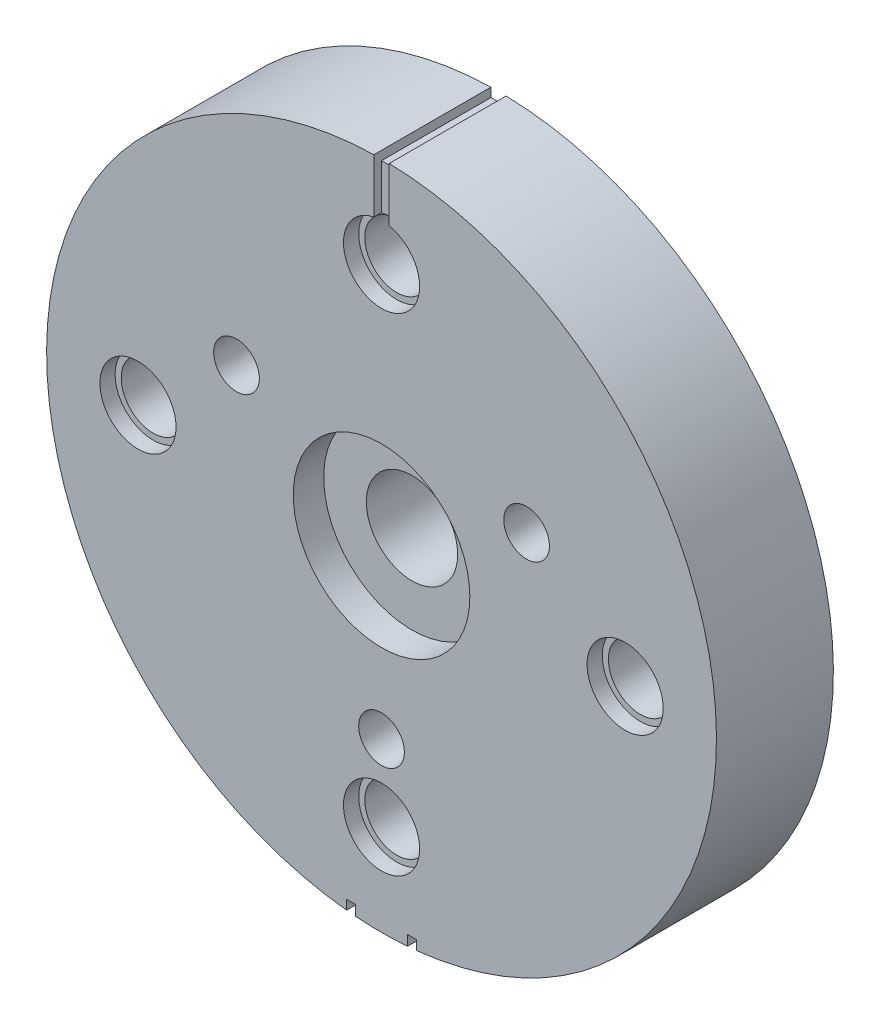
from build123d import *

# Parameters (mm, degrees)
SKETCH5_R           = 11
BOSS_EXTRUDE3_DEPTH = 3.84
SKETCH6_R           = 1.5
CUT_EXTRUDE16_DEPTH = 3.84
SKETCH6_8_R         = 2.9
SKETCH6_8_R_2       = 1.5
CUT_EXTRUDE17_DEPTH = 1
SKETCH7_R           = 0.75
CUT_EXTRUDE18_DEPTH = 2
SKETCH8_R           = 1.05
CUT_EXTRUDE20_DEPTH = 3
SKETCH8_4_R         = 1.25
SKETCH8_4_R_2       = 1.05
CUT_EXTRUDE21_DEPTH = 0.5
SKETCH15_W          = 0.299586516
SKETCH15_H          = 0.370347028
SKETCH15_W_2        = 0.300671414
CUT_EXTRUDE22_DEPTH = 3.84
SKETCH16_W          = 0.5
SKETCH16_H          = 0.298358963
CUT_EXTRUDE23_DEPTH = 3.84
SKETCH17_W          = 0.5
SKETCH17_H          = 1.60013733
CUT_EXTRUDE24_DEPTH = 0.25


with BuildPart() as part:
    # Sketch5 → Boss-Extrude3 (new body)
    with BuildSketch(Plane.XY):
        Circle(SKETCH5_R)
    extrude(amount=-BOSS_EXTRUDE3_DEPTH)

    # Sketch6 → Cut-Extrude16 (cut)
    with BuildSketch(Plane.XY):
        Circle(SKETCH6_R)
    extrude(amount=-CUT_EXTRUDE16_DEPTH, mode=Mode.SUBTRACT)

    # Sketch6<8> → Cut-Extrude17 (cut)
    with BuildSketch(Plane.XY):
        Circle(SKETCH6_8_R)
        Circle(SKETCH6_8_R_2, mode=Mode.SUBTRACT)
    extrude(amount=-CUT_EXTRUDE17_DEPTH, mode=Mode.SUBTRACT)

    # Sketch7 → Cut-Extrude18 (cut)
    with BuildSketch(Plane.XY):
        with Locations((-4.763139721, 2.75)):
            Circle(SKETCH7_R)
        with Locations((4.763139721, 2.75)):
            Circle(SKETCH7_R)
        with Locations((0, -5.5)):
            Circle(SKETCH7_R)
    extrude(amount=-CUT_EXTRUDE18_DEPTH, mode=Mode.SUBTRACT)

    # Sketch8 → Cut-Extrude20 (cut)
    with BuildSketch(Plane.XY):
        with Locations((-8, 0)):
            Circle(SKETCH8_R)
        with Locations((0, -8)):
            Circle(SKETCH8_R)
        with Locations((8, 0)):
            Circle(SKETCH8_R)
        with Locations((0, 8)):
            Circle(SKETCH8_R)
    extrude(amount=-CUT_EXTRUDE20_DEPTH, mode=Mode.SUBTRACT)

    # Sketch8<4> → Cut-Extrude21 (cut)
    # profile 1 of 4: a face of its own
    with BuildSketch(Plane.XY):
        with Locations((-8, 0)):
            Circle(SKETCH8_4_R)
        with Locations((-8, 0)):
            Circle(SKETCH8_4_R_2, mode=Mode.SUBTRACT)
    # profile 2 of 4: a face of its own
    with BuildSketch(Plane.XY):
        with Locations((0, -8)):
            Circle(SKETCH8_4_R)
        with Locations((0, -8)):
            Circle(SKETCH8_4_R_2, mode=Mode.SUBTRACT)
    # profile 3 of 4: a face of its own
    with BuildSketch(Plane.XY):
        with Locations((8, 0)):
            Circle(SKETCH8_4_R)
        with Locations((8, 0)):
            Circle(SKETCH8_4_R_2, mode=Mode.SUBTRACT)
    # profile 4 of 4: a face of its own
    with BuildSketch(Plane.XY):
        with Locations((0, 8)):
            Circle(SKETCH8_4_R)
        with Locations((0, 8)):
            Circle(SKETCH8_4_R_2, mode=Mode.SUBTRACT)
    extrude(amount=-CUT_EXTRUDE21_DEPTH, mode=Mode.SUBTRACT)

    # Sketch15 → Cut-Extrude22 (cut)
    with BuildSketch(Plane.XY):
        with Locations((-0.997080085, -10.814826486)):
            Rectangle(SKETCH15_W, SKETCH15_H)
        with Locations((1.003807665, -10.814826486)):
            Rectangle(SKETCH15_W_2, SKETCH15_H)
    extrude(amount=-CUT_EXTRUDE22_DEPTH, mode=Mode.SUBTRACT)

    # Sketch16 → Cut-Extrude23 (cut)
    with BuildSketch(Plane.XY):
        with Locations((0, 10.850819912)):
            Rectangle(SKETCH16_W, SKETCH16_H)
    extrude(amount=-CUT_EXTRUDE23_DEPTH, mode=Mode.SUBTRACT)

    # Sketch17 → Cut-Extrude24 (cut)
    with BuildSketch(Plane.XY):
        with Locations((0, 9.901571765)):
            Rectangle(SKETCH17_W, SKETCH17_H)
    extrude(amount=-CUT_EXTRUDE24_DEPTH, mode=Mode.SUBTRACT)


solid = part.part
